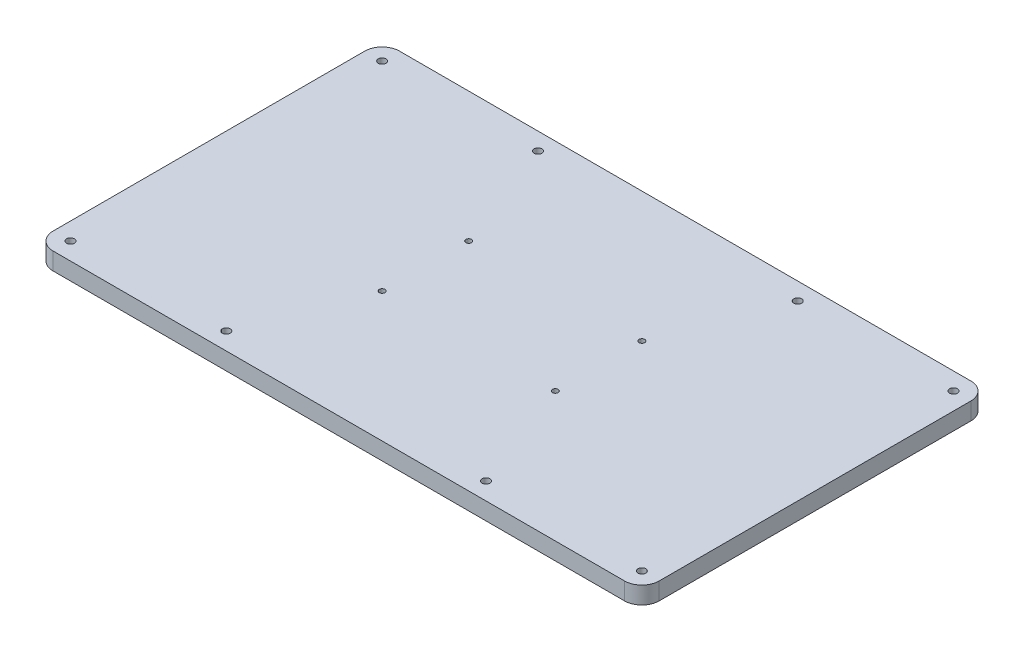
from build123d import *

# Parameters (mm, degrees)
SKETCH_1_W        = 350
SKETCH_1_H        = 200
EXTRUDE_1_DEPTH   = 10
M4X0_7_D          = 3.3
HOLE_WIZARD_M42_D = 4.5
FILLET_1_R        = 10


with BuildPart() as part:
    # Эскиз1 → Бобышка-Вытянуть1 (new body)
    with BuildSketch(Plane(origin=(0, 0, 0), x_dir=(1, 0, 0), z_dir=(0, 1, 0))):
        with Locations((175, 100)):
            Rectangle(SKETCH_1_W, SKETCH_1_H)
    extrude(amount=EXTRUDE_1_DEPTH)

    # Отверстие обработанное метчиком M4x0.7 (through all)
    with Locations(Plane(origin=(134.244811271, 10, -121.125670736), x_dir=(0, 0, -1), z_dir=(0, 1, 0))):
        with Locations((-46.125670736, 9.244811271), (3.874329264, 9.244811271), (3.874329264, -90.755188729), (-46.125670736, -90.755188729)):
            Hole(M4X0_7_D / 2)

    # Отверстие с зазором M42 (through all)
    with Locations(Plane(origin=(0, 10, 0), x_dir=(1, 0, 0), z_dir=(0, 1, 0))):
        with Locations((10, 10), (100, 10), (100, 190), (10, 190), (250, 190), (340, 190), (340, 10), (250, 10)):
            Hole(HOLE_WIZARD_M42_D / 2)

    # Скругление1
    fillet_1_edges = [part.edges().sort_by_distance(p)[0] for p in [
        (0, 5, -200),
        (350, 5, -200),
        (350, 5, 0),
        (0, 5, 0),
    ]]
    fillet(fillet_1_edges, radius=FILLET_1_R)


solid = part.part
